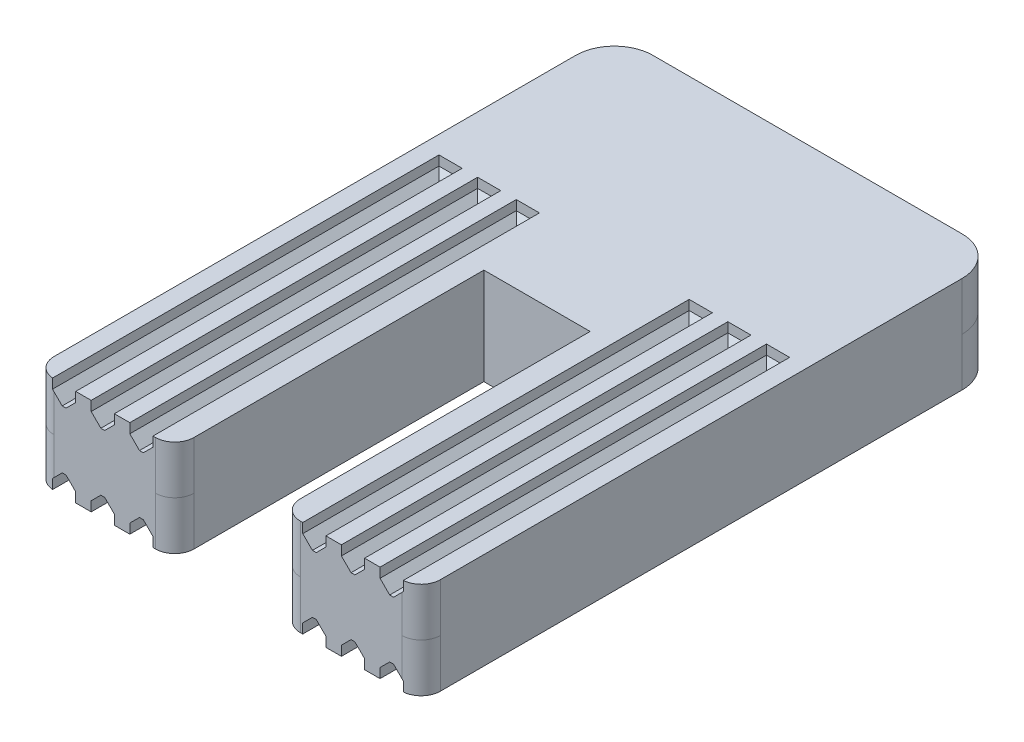
from build123d import *

# Parameters (mm, degrees)
ESBO_O1_W                 = 20
ESBO_O1_H                 = 30
RESSALTO_EXTRUS_O1_DEPTH  = 2.5
ESBO_O2_W                 = 5.5
ESBO_O2_H                 = 16
CORTE_EXTRUS_O1_DEPTH     = 5
FILETE1_R                 = 1
FILETE2_R                 = 2
FILETE3_R                 = 2
FILETE4_R                 = 1
FILETE5_R                 = 1
FILETE6_R                 = 1
ESBO_O3_W                 = 1.2
ESBO_O3_H                 = 20
CORTE_EXTRUS_O2_DEPTH     = 1
CHANFRO1_SIZE             = 0.5
CHANFRO3_SIZE             = 0.5
FILETE1_OF_ESPELHAR6_R    = 1
ESPELHAR7_COPY_1_SKETCH_W = 1.2
ESPELHAR7_COPY_1_SKETCH_H = 20
ESPELHAR7_COPY_1_DEPTH    = 1
ESPELHAR7_COPY_2_SKETCH_W = 1.2
ESPELHAR7_COPY_2_SKETCH_H = 20
ESPELHAR7_COPY_2_DEPTH    = 1
FILETE7_R                 = 2
FILETE8_R                 = 2
FILETE9_R                 = 1
CHANFRO4_SIZE             = 0.5
CHANFRO5_SIZE             = 0.5
FILETE10_R                = 1
FILETE11_R                = 1


with BuildPart() as part:
    # Esboço1 → Ressalto-extrusão1 (new body)
    with BuildSketch(Plane(origin=(0, 0, 0), x_dir=(1, 0, 0), z_dir=(0, 1, 0))):
        Rectangle(ESBO_O1_W, ESBO_O1_H)
    ressalto_extrus_o1 = extrude(amount=RESSALTO_EXTRUS_O1_DEPTH)

    # Esboço2 → Corte-extrusão1 (cut)
    with BuildSketch(Plane(origin=(0, 2.5, 0), x_dir=(1, 0, 0), z_dir=(0, 1, 0))):
        with Locations((0, -7)):
            Rectangle(ESBO_O2_W, ESBO_O2_H)
    corte_extrus_o1 = extrude(amount=-CORTE_EXTRUS_O1_DEPTH, mode=Mode.SUBTRACT)

    # Filete1
    filete1_edges = [part.edges().sort_by_distance(p)[0] for p in [
        (10, 1.25, 15),
    ]]
    fillet(filete1_edges, radius=FILETE1_R)

    # Filete2
    filete2_edges = [part.edges().sort_by_distance(p)[0] for p in [
        (10, 1.25, -15),
    ]]
    fillet(filete2_edges, radius=FILETE2_R)

    # Filete3
    filete3_edges = [part.edges().sort_by_distance(p)[0] for p in [
        (-10, 1.25, -15),
    ]]
    fillet(filete3_edges, radius=FILETE3_R)

    # Filete4
    filete4_edges = [part.edges().sort_by_distance(p)[0] for p in [
        (-10, 1.25, 15),
    ]]
    fillet(filete4_edges, radius=FILETE4_R)

    # Filete5
    filete5_edges = [part.edges().sort_by_distance(p)[0] for p in [
        (-2.75, 1.25, 15),
    ]]
    fillet(filete5_edges, radius=FILETE5_R)

    # Filete6
    filete6_edges = [part.edges().sort_by_distance(p)[0] for p in [
        (2.75, 1.25, 15),
    ]]
    fillet(filete6_edges, radius=FILETE6_R)

    # Esboço3 → Corte-extrusão2 (cut)
    with BuildSketch(Plane(origin=(0, 2.5, 0), x_dir=(1, 0, 0), z_dir=(0, 1, 0))):
        with Locations((-4.475, -5)):
            Rectangle(ESBO_O3_W, ESBO_O3_H)
        with Locations((-6.475, -5)):
            Rectangle(ESBO_O3_W, ESBO_O3_H)
        with Locations((-8.475, -5)):
            Rectangle(ESBO_O3_W, ESBO_O3_H)
    corte_extrus_o2 = extrude(amount=-CORTE_EXTRUS_O2_DEPTH, mode=Mode.SUBTRACT)

    # Chanfro1
    chanfro1_edges = [part.edges().sort_by_distance(p)[0] for p in [
        (-7.875, 1.5, 5),
        (-9.075, 1.5, 4.998591767),
        (-3.875, 1.5, 5),
        (-4.475, 1.5, -5),
        (-5.075, 1.5, 5),
        (-5.875, 1.5, 5),
        (-6.475, 1.5, -5),
        (-7.075, 1.5, 5),
        (-8.475, 1.5, -5),
    ]]
    chamfer(chanfro1_edges, length=CHANFRO1_SIZE)

    # Espelhar4: Corte-extrusão2 across plane
    add(corte_extrus_o2.mirror(Plane(origin=(0, 0, 0), x_dir=(0, 0, 1), z_dir=(1, 0, 0))), mode=Mode.SUBTRACT)

    # Chanfro3
    chanfro3_edges = [part.edges().sort_by_distance(p)[0] for p in [
        (9.075, 1.5, 4.998591767),
        (8.475, 1.5, -5),
        (7.875, 1.5, 5),
        (7.075, 1.5, 5),
        (6.475, 1.5, -5),
        (5.875, 1.5, 5),
        (5.075, 1.5, 5),
        (4.475, 1.5, -5),
        (3.875, 1.5, 5),
    ]]
    chamfer(chanfro3_edges, length=CHANFRO3_SIZE)

    # Espelhar5: Ressalto-extrusão1 across plane
    add(ressalto_extrus_o1.mirror(Plane.ZX))

    # Espelhar6: Corte-extrusão2 across plane
    add(corte_extrus_o2.mirror(Plane.ZX), mode=Mode.SUBTRACT)

    # Filete1 of Espelhar6
    filete1_of_espelhar6_edges = [part.edges().sort_by_distance(p)[0] for p in [
        (10, -1.25, 15),
    ]]
    fillet(filete1_of_espelhar6_edges, radius=FILETE1_OF_ESPELHAR6_R)

    # Espelhar7 copy 1 sketch → Espelhar7 copy 1 (cut)
    with BuildSketch(Plane(origin=(0, -2.5, 0), x_dir=(-1, 0, 0), z_dir=(0, -1, 0))):
        with Locations((-4.475, -5)):
            Rectangle(ESPELHAR7_COPY_1_SKETCH_W, ESPELHAR7_COPY_1_SKETCH_H)
        with Locations((-6.475, -5)):
            Rectangle(ESPELHAR7_COPY_1_SKETCH_W, ESPELHAR7_COPY_1_SKETCH_H)
        with Locations((-8.475, -5)):
            Rectangle(ESPELHAR7_COPY_1_SKETCH_W, ESPELHAR7_COPY_1_SKETCH_H)
    extrude(amount=-ESPELHAR7_COPY_1_DEPTH, mode=Mode.SUBTRACT)

    # Espelhar7 copy 2 sketch → Espelhar7 copy 2 (cut)
    with BuildSketch(Plane.XZ.offset(2.5)):
        with Locations((-4.475, 5)):
            Rectangle(ESPELHAR7_COPY_2_SKETCH_W, ESPELHAR7_COPY_2_SKETCH_H)
        with Locations((-6.475, 5)):
            Rectangle(ESPELHAR7_COPY_2_SKETCH_W, ESPELHAR7_COPY_2_SKETCH_H)
        with Locations((-8.475, 5)):
            Rectangle(ESPELHAR7_COPY_2_SKETCH_W, ESPELHAR7_COPY_2_SKETCH_H)
    extrude(amount=-ESPELHAR7_COPY_2_DEPTH, mode=Mode.SUBTRACT)

    # Filete7
    filete7_edges = [part.edges().sort_by_distance(p)[0] for p in [
        (10, -1.25, -15),
    ]]
    fillet(filete7_edges, radius=FILETE7_R)

    # Filete8
    filete8_edges = [part.edges().sort_by_distance(p)[0] for p in [
        (-10, -1.25, -15),
    ]]
    fillet(filete8_edges, radius=FILETE8_R)

    # Filete9
    filete9_edges = [part.edges().sort_by_distance(p)[0] for p in [
        (-10, -1.25, 15),
    ]]
    fillet(filete9_edges, radius=FILETE9_R)

    # Chanfro4
    chanfro4_edges = [part.edges().sort_by_distance(p)[0] for p in [
        (3.875, -1.5, 5),
        (4.475, -1.5, -5),
        (5.075, -1.5, 5),
        (5.875, -1.5, 5),
        (6.475, -1.5, -5),
        (7.075, -1.5, 5),
        (7.875, -1.5, 5),
        (8.475, -1.5, -5),
        (9.075, -1.5, 4.998591767),
    ]]
    chamfer(chanfro4_edges, length=CHANFRO4_SIZE)

    # Chanfro5
    chanfro5_edges = [part.edges().sort_by_distance(p)[0] for p in [
        (-9.075, -1.5, 4.998591767),
        (-8.475, -1.5, -5),
        (-7.875, -1.5, 5),
        (-7.075, -1.5, 5),
        (-6.475, -1.5, -5),
        (-5.875, -1.5, 5),
        (-5.075, -1.5, 5),
        (-4.475, -1.5, -5),
        (-3.875, -1.5, 5),
    ]]
    chamfer(chanfro5_edges, length=CHANFRO5_SIZE)

    # Espelhar8: Corte-extrusão1 across plane
    add(corte_extrus_o1.mirror(Plane.ZX), mode=Mode.SUBTRACT)

    # Filete10
    filete10_edges = [part.edges().sort_by_distance(p)[0] for p in [
        (2.75, -1.25, 15),
    ]]
    fillet(filete10_edges, radius=FILETE10_R)

    # Filete11
    filete11_edges = [part.edges().sort_by_distance(p)[0] for p in [
        (-2.75, -1.25, 15),
    ]]
    fillet(filete11_edges, radius=FILETE11_R)


solid = part.part
